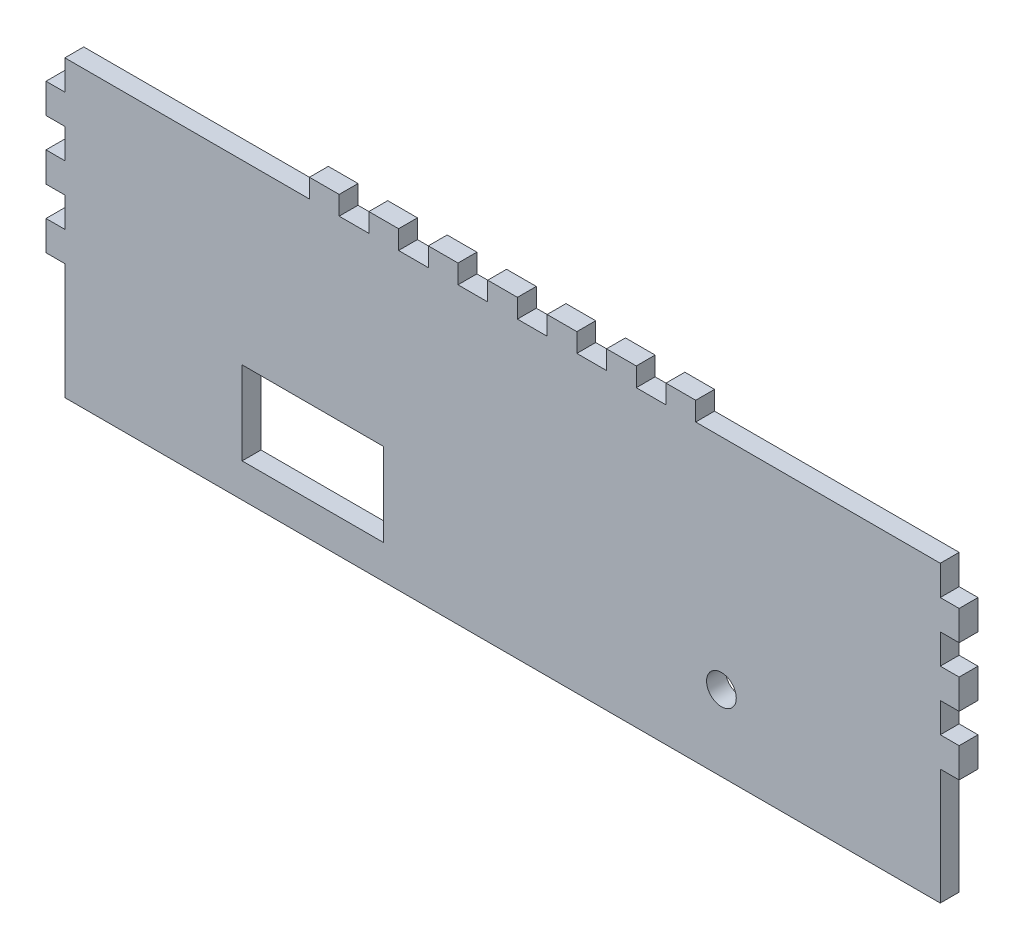
from build123d import *

# Parameters (mm, degrees)
SKETCH1_R           = 2.5
SKETCH1_W           = 23.8125
SKETCH1_H           = 14
BOSS_EXTRUDE1_DEPTH = 3.175


with BuildPart() as part:
    # Sketch1 → Boss-Extrude1 (new body)
    with BuildSketch(Plane.XY):
        Polygon((-147.32, 0), (-106.16, 0), (-106.16, 3.175), (-101.16, 3.175), (-101.16, 0), (-96.16, 0), (-96.16, 3.175), (-91.16, 3.175), (-91.16, 0), (-86.16, 0), (-86.16, 3.175), (-81.16, 3.175), (-81.16, 0), (-76.16, 0), (-76.16, 3.175), (-71.16, 3.175), (-71.16, 0), (-66.16, 0), (-66.16, 3.175), (-61.16, 3.175), (-61.16, 0), (-56.16, 0), (-56.16, 3.175), (-51.16, 3.175), (-51.16, 0), (-46.16, 0), (-46.16, 3.175), (-41.16, 3.175), (-41.16, 0), (0, 0), (0, -5), (3.175, -5), (3.175, -10), (0, -10), (0, -15), (3.175, -15), (3.175, -20), (0, -20), (0, -25), (3.175, -25), (3.175, -30), (0, -30), (0, -49.53), (-147.32, -49.53), (-147.32, -30), (-150.495, -30), (-150.495, -25), (-147.32, -25), (-147.32, -20), (-150.495, -20), (-150.495, -15), (-147.32, -15), (-147.32, -10), (-150.495, -10), (-150.495, -5), (-147.32, -5), align=None)
        with Locations((-36.83, -36.83)):
            Circle(SKETCH1_R, mode=Mode.SUBTRACT)
        with Locations((-105.58375, -36.83)):
            Rectangle(SKETCH1_W, SKETCH1_H, mode=Mode.SUBTRACT)
    extrude(amount=BOSS_EXTRUDE1_DEPTH)


solid = part.part
